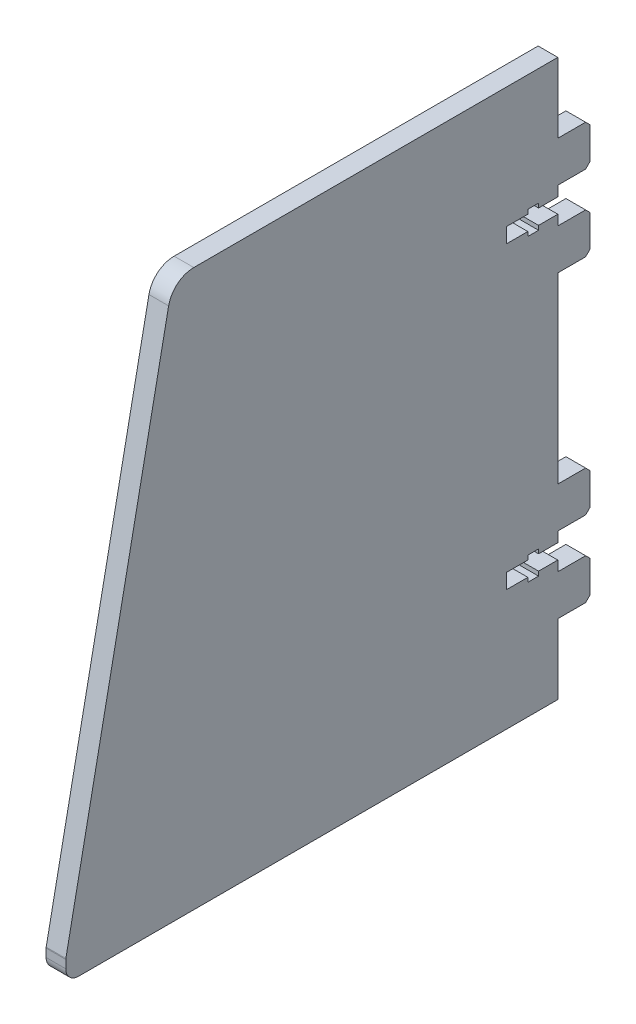
from build123d import *

# Parameters (mm, degrees)
EXTRUDE1_DEPTH = 4.6
SKETCH2_R      = 1
EXTRUDE2_DEPTH = 1


with BuildPart() as part:
    # Sketch1 → Extrude1 (new body)
    with BuildSketch(Plane(origin=(0, 0, 0), x_dir=(0, 0, -1), z_dir=(1, 0, 0))):
        with BuildLine():
            Line((120.06791936, 91.267546052), (126.56791936, 91.267546052))
            Line((126.56791936, 91.267546052), (127.56791936, 92.267546052))
            Line((127.56791936, 92.267546052), (127.56791936, 99.767546052))
            Line((127.56791936, 99.767546052), (126.56791936, 100.767546052))
            Line((126.56791936, 100.767546052), (120.06791936, 100.767546052))
            Line((120.06791936, 100.767546052), (120.06791936, 103.142546052))
            Line((120.06791936, 103.142546052), (115.56791936, 103.142546052))
            Line((115.56791936, 103.142546052), (115.56791936, 102.142546052))
            Line((115.56791936, 102.142546052), (113.06791936, 102.142546052))
            Line((113.06791936, 102.142546052), (113.06791936, 103.142546052))
            Line((113.06791936, 103.142546052), (108.06791936, 103.142546052))
            Line((108.06791936, 103.142546052), (108.06791936, 106.642546052))
            Line((108.06791936, 106.642546052), (113.06791936, 106.642546052))
            Line((113.06791936, 106.642546052), (113.06791936, 107.642546052))
            Line((113.06791936, 107.642546052), (115.56791936, 107.642546052))
            Line((115.56791936, 107.642546052), (115.56791936, 106.642546052))
            Line((115.56791936, 106.642546052), (120.06791936, 106.642546052))
            Line((120.06791936, 106.642546052), (120.06791936, 109.017546052))
            Line((120.06791936, 109.017546052), (126.56791936, 109.017546052))
            Line((126.56791936, 109.017546052), (127.56791936, 110.017546052))
            Line((127.56791936, 110.017546052), (127.56791936, 117.517546052))
            Line((127.56791936, 117.517546052), (126.56791936, 118.517546052))
            Line((126.56791936, 118.517546052), (120.06791936, 118.517546052))
            Line((120.06791936, 118.517546052), (120.06791936, 134.892546052))
            Line((120.06791936, 134.892546052), (34.986742776, 134.892546052))
            ThreePointArc((34.986742776, 134.892546052), (31.182809342, 133.5325989), (29.103258722, 130.069242862))
            Line((29.103258722, 130.069242862), (5.087338684, 9.989642673))
            ThreePointArc((5.087338684, 9.989642673), (5.072786033, 9.892064156), (5.06791936, 9.793526538))
            Line((5.06791936, 9.793526538), (5.06791936, 7.892546052))
            ThreePointArc((5.06791936, 7.892546052), (5.946599016, 5.771225708), (8.06791936, 4.892546052))
            Line((8.06791936, 4.892546052), (120.06791936, 4.892546052))
            Line((120.06791936, 4.892546052), (120.06791936, 21.267546052))
            Line((120.06791936, 21.267546052), (126.56791936, 21.267546052))
            Line((126.56791936, 21.267546052), (127.56791936, 22.267546052))
            Line((127.56791936, 22.267546052), (127.56791936, 29.767546052))
            Line((127.56791936, 29.767546052), (126.56791936, 30.767546052))
            Line((126.56791936, 30.767546052), (120.06791936, 30.767546052))
            Line((120.06791936, 30.767546052), (120.06791936, 33.142546052))
            Line((120.06791936, 33.142546052), (115.56791936, 33.142546052))
            Line((115.56791936, 33.142546052), (115.56791936, 32.142546052))
            Line((115.56791936, 32.142546052), (113.06791936, 32.142546052))
            Line((113.06791936, 32.142546052), (113.06791936, 33.142546052))
            Line((113.06791936, 33.142546052), (108.06791936, 33.142546052))
            Line((108.06791936, 33.142546052), (108.06791936, 36.642546052))
            Line((108.06791936, 36.642546052), (113.06791936, 36.642546052))
            Line((113.06791936, 36.642546052), (113.06791936, 37.642546052))
            Line((113.06791936, 37.642546052), (115.56791936, 37.642546052))
            Line((115.56791936, 37.642546052), (115.56791936, 36.642546052))
            Line((115.56791936, 36.642546052), (120.06791936, 36.642546052))
            Line((120.06791936, 36.642546052), (120.06791936, 39.017546052))
            Line((120.06791936, 39.017546052), (126.56791936, 39.017546052))
            Line((126.56791936, 39.017546052), (127.56791936, 40.017546052))
            Line((127.56791936, 40.017546052), (127.56791936, 47.517546052))
            Line((127.56791936, 47.517546052), (126.56791936, 48.517546052))
            Line((126.56791936, 48.517546052), (120.06791936, 48.517546052))
            Line((120.06791936, 48.517546052), (120.06791936, 91.267546052))
        make_face()
    extrude(amount=EXTRUDE1_DEPTH)

    # Sketch2 → Extrude2 (cut)
    with BuildSketch(Plane(origin=(0, 0, -108.06791936), x_dir=(-1, 0, 0), z_dir=(0, 0, -1))):
        with Locations((-2.3, 34.892546052)):
            Circle(SKETCH2_R)
        with Locations((-2.3, 104.892546052)):
            Circle(SKETCH2_R)
    extrude(amount=-EXTRUDE2_DEPTH, mode=Mode.SUBTRACT)


solid = part.part
